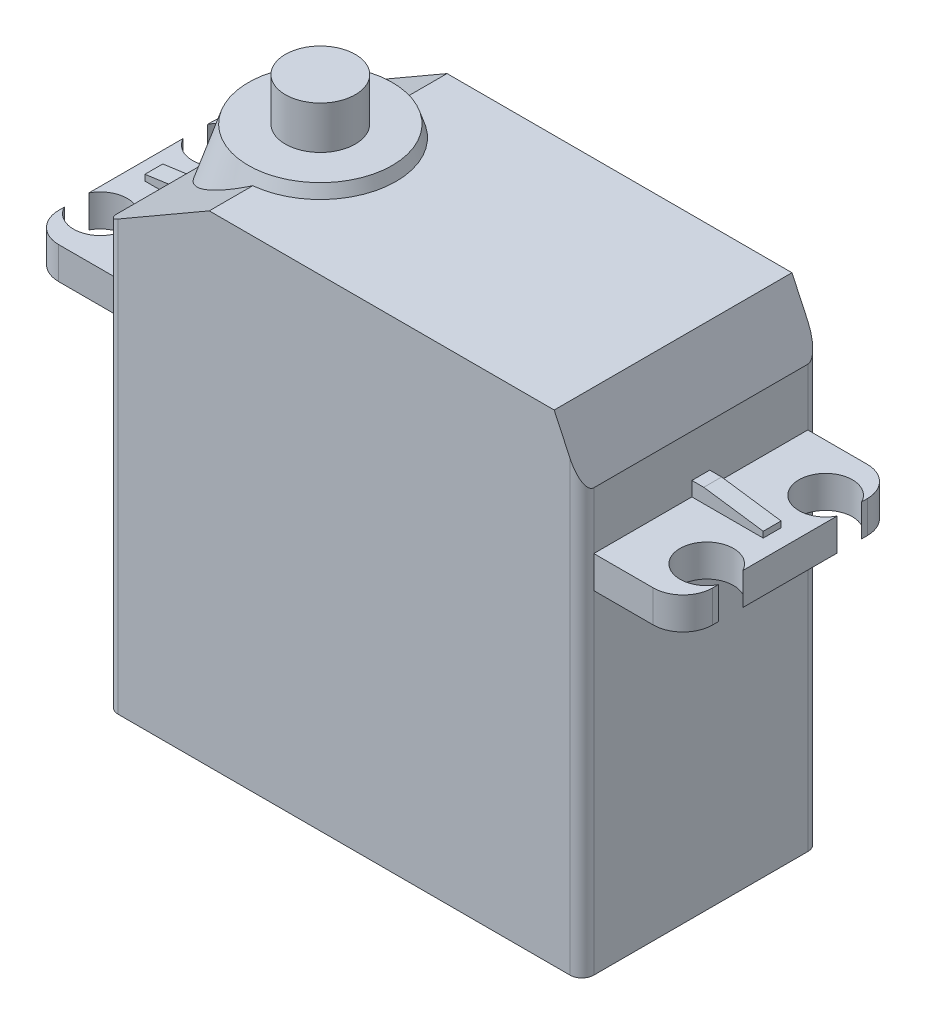
from build123d import *

# Parameters (mm, degrees)
SALIENTE_EXTRUIR1_DEPTH = 20
REDONDEO1_R             = 1
CROQUIS2_R              = 8
SALIENTE_EXTRUIR2_DEPTH = 6
SALIENTE_EXTRUIR2_DRAFT = -18
CROQUIS3_R              = 2.94
SALIENTE_EXTRUIR3_DEPTH = 3.6
SALIENTE_EXTRUIR4_DEPTH = 2.7
SALIENTE_EXTRUIR5_DEPTH = 0.75


with BuildPart() as part:
    # Croquis1 → Saliente-Extruir1 (new body)
    with BuildSketch(Plane.XY):
        Polygon((40, 0), (0, 0), (0, 35.5), (8.658841891, 40.499184697), (37.668841891, 40.499184697), (40, 35.5), align=None)
    extrude(amount=SALIENTE_EXTRUIR1_DEPTH)

    # Redondeo1
    redondeo1_edges = [part.edges().sort_by_distance(p)[0] for p in [
        (0, 17.75, 0),
        (0, 17.75, 20),
        (40, 17.75, 0),
        (40, 17.75, 20),
    ]]
    fillet(redondeo1_edges, radius=REDONDEO1_R)


with BuildPart() as saliente_extruir2_tool:
    # Croquis2 → Saliente-Extruir2 (with draft: the straight prism first)
    with BuildSketch(Plane(origin=(0, 35.5, 0), x_dir=(-1, 0, 0), z_dir=(0, -1, 0))):
        with Locations((-8, -10)):
            Circle(CROQUIS2_R)
    extrude(amount=-SALIENTE_EXTRUIR2_DEPTH)
    # Saliente-Extruir2: the draft: its side faces are tilted about the plane it starts from
    saliente_extruir2_sides = [saliente_extruir2_tool.faces().sort_by_distance(p)[0] for p in [
        (16, 38.5, 10),
    ]]
    draft(saliente_extruir2_sides, Plane(origin=(0, 35.5, 0), x_dir=(-1, 0, 0), z_dir=(0, -1, 0)), SALIENTE_EXTRUIR2_DRAFT)


with BuildPart() as part_1:
    add(part.part)

    # Saliente-Extruir2: add saliente_extruir2_tool
    add(saliente_extruir2_tool.part)

    # Croquis3 → Saliente-Extruir3 (add)
    with BuildSketch(Plane(origin=(0, 41.5, 0), x_dir=(1, 0, 0), z_dir=(0, 1, 0))):
        with Locations((8, -10)):
            Circle(CROQUIS3_R)
    extrude(amount=SALIENTE_EXTRUIR3_DEPTH)

    # Croquis4 → Saliente-Extruir4 (add)
    with BuildSketch(Plane(origin=(0, 28.01, 0), x_dir=(-1, 0, 0), z_dir=(0, -1, 0))):
        with BuildLine():
            Line((-45, -19), (-40, -19))
            Line((-40, -19), (-40, -1))
            Line((-40, -1), (-45, -1))
            ThreePointArc((-45, -1), (-46.767766953, -1.732233047), (-47.5, -3.5))
            Line((-47.5, -3.5), (-47.5, -3.969223594))
            ThreePointArc((-47.5, -3.969223594), (-43.25, -5), (-47.5, -6.030776406))
            Line((-47.5, -6.030776406), (-47.5, -13.969223594))
            ThreePointArc((-47.5, -13.969223594), (-43.25, -15), (-47.5, -16.030776406))
            Line((-47.5, -16.030776406), (-47.5, -16.5))
            ThreePointArc((-47.5, -16.5), (-46.767766953, -18.267766953), (-45, -19))
        make_face()
        with BuildLine():
            Line((0, -19), (5, -19))
            ThreePointArc((5, -19), (6.767766953, -18.267766953), (7.5, -16.5))
            Line((7.5, -16.5), (7.5, -16.030776406))
            ThreePointArc((7.5, -16.030776406), (3.25, -15), (7.5, -13.969223594))
            Line((7.5, -13.969223594), (7.5, -6.030776406))
            ThreePointArc((7.5, -6.030776406), (3.25, -5), (7.5, -3.969223594))
            Line((7.5, -3.969223594), (7.5, -3.5))
            ThreePointArc((7.5, -3.5), (6.767766953, -1.732233047), (5, -1))
            Line((5, -1), (0, -1))
            Line((0, -1), (0, -19))
        make_face()
    extrude(amount=-SALIENTE_EXTRUIR4_DEPTH)

    # Croquis5 → Saliente-Extruir5 (add, symmetric)
    with BuildSketch(Plane.XY.offset(10)):
        Polygon((-6, 31.21), (-1.000247602, 31.91), (0, 31.91), (0, 30.71), (-6, 30.71), align=None)
        Polygon((40, 31.91), (41.000247602, 31.91), (46, 31.21), (46, 30.71), (40, 30.71), align=None)
    extrude(amount=SALIENTE_EXTRUIR5_DEPTH, both=True)


solid = part_1.part
